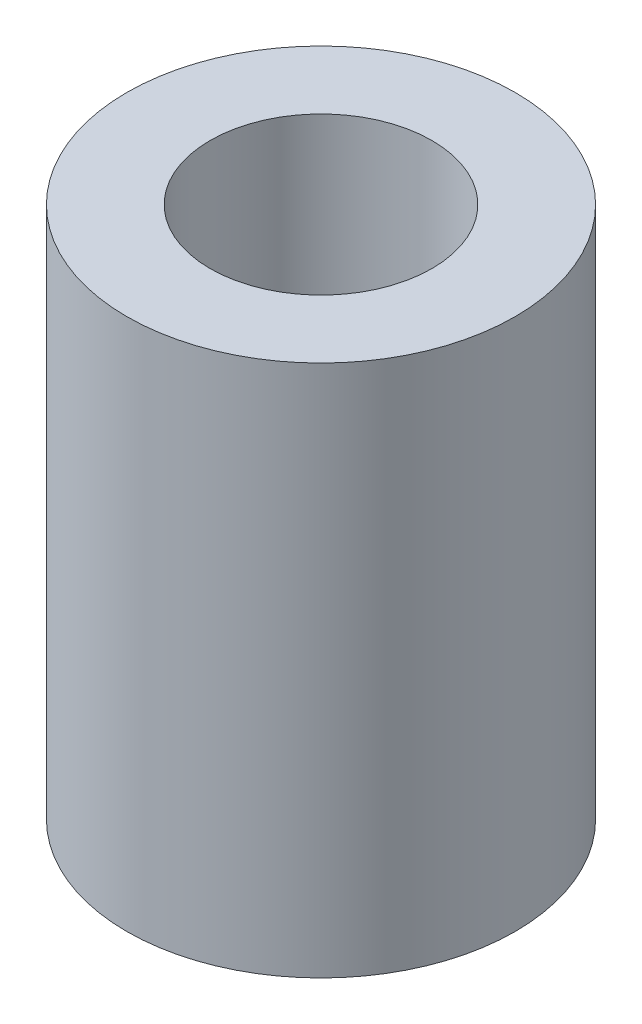
from build123d import *

# Parameters (mm, degrees)
SKETCH1_R           = 4.445
SKETCH1_R_2         = 2.54
BOSS_EXTRUDE1_DEPTH = 12.192


with BuildPart() as part:
    # Sketch1 → Boss-Extrude1 (new body)
    with BuildSketch(Plane(origin=(0, 0, 0), x_dir=(1, 0, 0), z_dir=(0, 1, 0))):
        Circle(SKETCH1_R)
        Circle(SKETCH1_R_2, mode=Mode.SUBTRACT)
    extrude(amount=BOSS_EXTRUDE1_DEPTH)


solid = part.part
